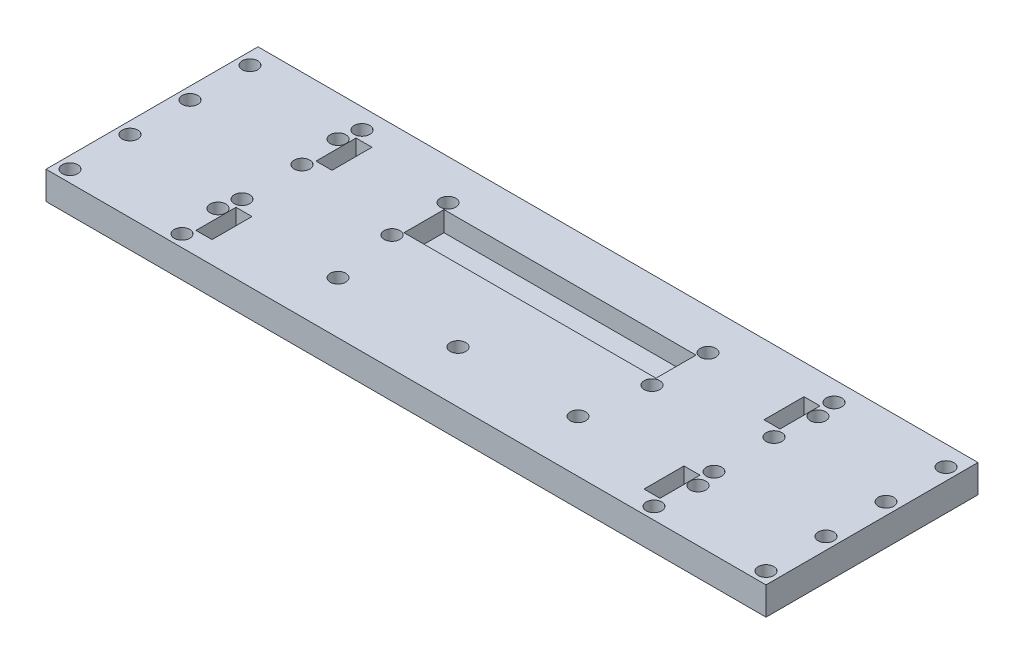
from build123d import *

# Parameters (mm, degrees)
SKETCH_1_W          = 25
SKETCH_1_H          = 30
SKETCH_1_R          = 1.95
SKETCH_1_W_2        = 15
SKETCH_1_H_2        = 60
EXTRUDE_1_DEPTH     = 7
SKETCH_2_R          = 1.95
CUT_EXTRUDE_1_DEPTH = 6
SKETCH_4_W          = 4
SKETCH_4_H          = 10
CUT_EXTRUDE_2_DEPTH = 5
SKETCH_5_W          = 180
SKETCH_5_H          = 7
CUT_EXTRUDE_3_DEPTH = 10
SKETCH_6_W          = 100
SKETCH_6_H          = 7
EXTRUDE_2_DEPTH     = 30
CUT_EXTRUDE_4_DEPTH = 5
CUT_EXTRUDE_5_DEPTH = 5


with BuildPart() as part:
    # 草图1 → 凸台-拉伸1 (new body)
    # profile 1 of 6: a face of its own
    with BuildSketch(Plane(origin=(0, 0, 0), x_dir=(1, 0, 0), z_dir=(0, 1, 0))):
        with Locations((12.5, 45)):
            Rectangle(SKETCH_1_W, SKETCH_1_H)
        with Locations(Location((15, 50, 0), (0, 0, 270))):
            Circle(SKETCH_1_R, mode=Mode.SUBTRACT)
    # profile 2 of 6: a face of its own
    with BuildSketch(Plane(origin=(0, 0, 0), x_dir=(1, 0, 0), z_dir=(0, 1, 0))):
        with BuildLine():
            Line((150, 20), (136.95, 20))
            ThreePointArc((136.95, 20), (135, 18.05), (133.05, 20))
            Line((133.05, 20), (106.95, 20))
            ThreePointArc((106.95, 20), (105, 18.05), (103.05, 20))
            Line((103.05, 20), (76.95, 20))
            ThreePointArc((76.95, 20), (75, 18.05), (73.05, 20))
            Line((73.05, 20), (46.95, 20))
            ThreePointArc((46.95, 20), (45, 18.05), (43.05, 20))
            Line((43.05, 20), (16.95, 20))
            ThreePointArc((16.95, 20), (15, 18.05), (13.05, 20))
            Line((13.05, 20), (0, 20))
            Line((0, 20), (0, 0))
            Line((0, 0), (150, 0))
            Line((150, 0), (150, 20))
        make_face()
    # profile 3 of 6: a face of its own
    with BuildSketch(Plane(origin=(0, 0, 0), x_dir=(1, 0, 0), z_dir=(0, 1, 0))):
        with BuildLine():
            ThreePointArc((133.05, 20), (135, 21.95), (136.95, 20))
            Line((136.95, 20), (150, 20))
            Line((150, 20), (150, 30))
            Line((150, 30), (125, 30))
            Line((125, 30), (25, 30))
            Line((25, 30), (0, 30))
            Line((0, 30), (0, 20))
            Line((0, 20), (13.05, 20))
            ThreePointArc((13.05, 20), (15, 21.95), (16.95, 20))
            Line((16.95, 20), (43.05, 20))
            ThreePointArc((43.05, 20), (45, 21.95), (46.95, 20))
            Line((46.95, 20), (73.05, 20))
            ThreePointArc((73.05, 20), (75, 21.95), (76.95, 20))
            Line((76.95, 20), (103.05, 20))
            ThreePointArc((103.05, 20), (105, 21.95), (106.95, 20))
            Line((106.95, 20), (133.05, 20))
        make_face()
    # profile 4 of 6: a face of its own
    with BuildSketch(Plane(origin=(0, 0, 0), x_dir=(1, 0, 0), z_dir=(0, 1, 0))):
        with Locations((137.5, 45)):
            Rectangle(SKETCH_1_W, SKETCH_1_H)
        with Locations(Location((135, 50, 0), (0, 0, 270))):
            Circle(SKETCH_1_R, mode=Mode.SUBTRACT)
    # profile 5 of 6: a face of its own
    with BuildSketch(Plane(origin=(0, 0, 0), x_dir=(1, 0, 0), z_dir=(0, 1, 0))):
        with Locations((-7.5, 30)):
            Rectangle(SKETCH_1_W_2, SKETCH_1_H_2)
    # profile 6 of 6: a face of its own
    with BuildSketch(Plane(origin=(0, 0, 0), x_dir=(1, 0, 0), z_dir=(0, 1, 0))):
        with Locations((157.5, 30)):
            Rectangle(SKETCH_1_W_2, SKETCH_1_H_2)
    extrude(amount=EXTRUDE_1_DEPTH)

    # 草图2 → 切除-拉伸1 (cut)
    with BuildSketch(Plane(origin=(0, 7, 0), x_dir=(1, 0, 0), z_dir=(0, 1, 0))):
        with BuildLine():
            Line((-12, 53.05), (-12, 55))
            Line((-12, 55), (-10.05, 55))
            ThreePointArc((-10.05, 55), (-13.378858223, 56.378858223), (-12, 53.05))
        make_face()
        with BuildLine():
            Line((-10.05, 55), (-12, 55))
            Line((-12, 55), (-12, 53.05))
            ThreePointArc((-12, 53.05), (-10.621141777, 53.621141777), (-10.05, 55))
        make_face()
        with BuildLine():
            Line((-12, 53.05), (-12, 55))
            Line((-12, 55), (-10.05, 55))
            ThreePointArc((-10.05, 55), (-13.378858223, 56.378858223), (-12, 53.05))
        make_face()
        with BuildLine():
            Line((-10.05, 55), (-12, 55))
            Line((-12, 55), (-12, 53.05))
            ThreePointArc((-12, 53.05), (-10.621141777, 53.621141777), (-10.05, 55))
        make_face()
        with BuildLine():
            ThreePointArc((-10.05, 40), (-10.621141777, 41.378858223), (-12, 41.95))
            Line((-12, 41.95), (-12, 40))
            Line((-12, 40), (-10.05, 40))
        make_face()
        with BuildLine():
            Line((-12, 40), (-12, 41.95))
            ThreePointArc((-12, 41.95), (-13.378858223, 38.621141777), (-10.05, 40))
            Line((-10.05, 40), (-12, 40))
        make_face()
        with BuildLine():
            ThreePointArc((-10.05, 40), (-10.621141777, 41.378858223), (-12, 41.95))
            Line((-12, 41.95), (-12, 40))
            Line((-12, 40), (-10.05, 40))
        make_face()
        with BuildLine():
            Line((-12, 40), (-12, 41.95))
            ThreePointArc((-12, 41.95), (-13.378858223, 38.621141777), (-10.05, 40))
            Line((-10.05, 40), (-12, 40))
        make_face()
        with BuildLine():
            ThreePointArc((17.95, 40), (17.378858223, 41.378858223), (16, 41.95))
            Line((16, 41.95), (16, 40))
            Line((16, 40), (14.05, 40))
            ThreePointArc((14.05, 40), (16, 38.05), (17.95, 40))
        make_face()
        with BuildLine():
            Line((16, 40), (16, 41.95))
            ThreePointArc((16, 41.95), (14.621141777, 41.378858223), (14.05, 40))
            Line((14.05, 40), (16, 40))
        make_face()
        with BuildLine():
            ThreePointArc((17.95, 40), (17.378858223, 41.378858223), (16, 41.95))
            Line((16, 41.95), (16, 40))
            Line((16, 40), (14.05, 40))
            ThreePointArc((14.05, 40), (16, 38.05), (17.95, 40))
        make_face()
        with BuildLine():
            Line((16, 40), (16, 41.95))
            ThreePointArc((16, 41.95), (14.621141777, 41.378858223), (14.05, 40))
            Line((14.05, 40), (16, 40))
        make_face()
        with BuildLine():
            ThreePointArc((17.95, 55), (16, 56.95), (14.05, 55))
            Line((14.05, 55), (16, 55))
            Line((16, 55), (16, 53.05))
            ThreePointArc((16, 53.05), (17.378858223, 53.621141777), (17.95, 55))
        make_face()
        with BuildLine():
            Line((16, 55), (14.05, 55))
            ThreePointArc((14.05, 55), (14.621141777, 53.621141777), (16, 53.05))
            Line((16, 53.05), (16, 55))
        make_face()
        with BuildLine():
            ThreePointArc((17.95, 55), (16, 56.95), (14.05, 55))
            Line((14.05, 55), (16, 55))
            Line((16, 55), (16, 53.05))
            ThreePointArc((16, 53.05), (17.378858223, 53.621141777), (17.95, 55))
        make_face()
        with BuildLine():
            Line((16, 55), (14.05, 55))
            ThreePointArc((14.05, 55), (14.621141777, 53.621141777), (16, 53.05))
            Line((16, 53.05), (16, 55))
        make_face()
        with BuildLine():
            ThreePointArc((-10.05, 10), (-10.621141777, 11.378858223), (-12, 11.95))
            Line((-12, 11.95), (-12, 10))
            Line((-12, 10), (-10.05, 10))
        make_face()
        with BuildLine():
            Line((-12, 10), (-12, 11.95))
            ThreePointArc((-12, 11.95), (-13.378858223, 8.621141777), (-10.05, 10))
            Line((-10.05, 10), (-12, 10))
        make_face()
        with BuildLine():
            ThreePointArc((-10.05, 10), (-10.621141777, 11.378858223), (-12, 11.95))
            Line((-12, 11.95), (-12, 10))
            Line((-12, 10), (-10.05, 10))
        make_face()
        with BuildLine():
            Line((-12, 10), (-12, 11.95))
            ThreePointArc((-12, 11.95), (-13.378858223, 8.621141777), (-10.05, 10))
            Line((-10.05, 10), (-12, 10))
        make_face()
        with BuildLine():
            Line((-10.05, 25), (-12, 25))
            Line((-12, 25), (-12, 23.05))
            ThreePointArc((-12, 23.05), (-10.621141777, 23.621141777), (-10.05, 25))
        make_face()
        with BuildLine():
            Line((-12, 23.05), (-12, 25))
            Line((-12, 25), (-10.05, 25))
            ThreePointArc((-10.05, 25), (-13.378858223, 26.378858223), (-12, 23.05))
        make_face()
        with BuildLine():
            Line((-10.05, 25), (-12, 25))
            Line((-12, 25), (-12, 23.05))
            ThreePointArc((-12, 23.05), (-10.621141777, 23.621141777), (-10.05, 25))
        make_face()
        with BuildLine():
            Line((-12, 23.05), (-12, 25))
            Line((-12, 25), (-10.05, 25))
            ThreePointArc((-10.05, 25), (-13.378858223, 26.378858223), (-12, 23.05))
        make_face()
        with BuildLine():
            ThreePointArc((17.95, 25), (16, 26.95), (14.05, 25))
            Line((14.05, 25), (16, 25))
            Line((16, 25), (16, 23.05))
            ThreePointArc((16, 23.05), (17.378858223, 23.621141777), (17.95, 25))
        make_face()
        with BuildLine():
            Line((16, 25), (14.05, 25))
            ThreePointArc((14.05, 25), (14.621141777, 23.621141777), (16, 23.05))
            Line((16, 23.05), (16, 25))
        make_face()
        with BuildLine():
            ThreePointArc((17.95, 25), (16, 26.95), (14.05, 25))
            Line((14.05, 25), (16, 25))
            Line((16, 25), (16, 23.05))
            ThreePointArc((16, 23.05), (17.378858223, 23.621141777), (17.95, 25))
        make_face()
        with BuildLine():
            Line((16, 25), (14.05, 25))
            ThreePointArc((14.05, 25), (14.621141777, 23.621141777), (16, 23.05))
            Line((16, 23.05), (16, 25))
        make_face()
        with BuildLine():
            ThreePointArc((16, 11.95), (14.621141777, 11.378858223), (14.05, 10))
            Line((14.05, 10), (16, 10))
            Line((16, 10), (16, 11.95))
        make_face()
        with BuildLine():
            Line((16, 10), (14.05, 10))
            ThreePointArc((14.05, 10), (16, 8.05), (17.95, 10))
            ThreePointArc((17.95, 10), (17.378858223, 11.378858223), (16, 11.95))
            Line((16, 11.95), (16, 10))
        make_face()
        with BuildLine():
            ThreePointArc((16, 11.95), (14.621141777, 11.378858223), (14.05, 10))
            Line((14.05, 10), (16, 10))
            Line((16, 10), (16, 11.95))
        make_face()
        with BuildLine():
            Line((16, 10), (14.05, 10))
            ThreePointArc((14.05, 10), (16, 8.05), (17.95, 10))
            ThreePointArc((17.95, 10), (17.378858223, 11.378858223), (16, 11.95))
            Line((16, 11.95), (16, 10))
        make_face()
        with Locations(Location((134, 10, 0), (0, 0, 270))):
            Circle(SKETCH_2_R)
        with Locations(Location((162, 10, 0), (0, 0, 270))):
            Circle(SKETCH_2_R)
        with Locations(Location((162, 25, 0), (0, 0, 270))):
            Circle(SKETCH_2_R)
        with Locations(Location((134, 25, 0), (0, 0, 270))):
            Circle(SKETCH_2_R)
        with Locations(Location((134, 40, 0), (0, 0, 270))):
            Circle(SKETCH_2_R)
        with Locations(Location((134, 55, 0), (0, 0, 270))):
            Circle(SKETCH_2_R)
        with Locations(Location((162, 55, 0), (0, 0, 270))):
            Circle(SKETCH_2_R)
        with Locations(Location((162, 40, 0), (0, 0, 270))):
            Circle(SKETCH_2_R)
    extrude(amount=-CUT_EXTRUDE_1_DEPTH, mode=Mode.SUBTRACT)

    # 草图4 → 切除-拉伸2 (cut)
    with BuildSketch(Plane(origin=(0, 7, 0), x_dir=(1, 0, 0), z_dir=(0, 1, 0))):
        with Locations((131, 47.5)):
            Rectangle(SKETCH_4_W, SKETCH_4_H)
        with Locations((131, 17.5)):
            Rectangle(SKETCH_4_W, SKETCH_4_H)
        with Locations((19, 17.5)):
            Rectangle(SKETCH_4_W, SKETCH_4_H)
        with Locations((19, 47.5)):
            Rectangle(SKETCH_4_W, SKETCH_4_H)
    extrude(amount=-CUT_EXTRUDE_2_DEPTH, mode=Mode.SUBTRACT)

    # 草图5 → 切除-拉伸3 (cut)
    with BuildSketch(Plane(origin=(0, 7, 0), x_dir=(1, 0, 0), z_dir=(0, 1, 0))):
        with Locations((75, 3.5)):
            Rectangle(SKETCH_5_W, SKETCH_5_H)
    extrude(amount=-CUT_EXTRUDE_3_DEPTH, mode=Mode.SUBTRACT)

    # 草图6 → 凸台-拉伸2 (add, through all)
    with BuildSketch(Plane(origin=(0, 0, -30), x_dir=(-1, 0, 0), z_dir=(0, 0, -1))):
        with Locations((-75, 3.5)):
            Rectangle(SKETCH_6_W, SKETCH_6_H)
    extrude(amount=EXTRUDE_2_DEPTH)

    # 草图7 → 切除-拉伸4 (cut)
    with BuildSketch(Plane(origin=(0, 7, 0), x_dir=(1, 0, 0), z_dir=(0, 1, 0))):
        with BuildLine():
            ThreePointArc((42.5, 48.05), (43.878858223, 48.621141777), (44.45, 50))
            Line((44.45, 50), (42.5, 50))
            Line((42.5, 50), (42.5, 48.05))
        make_face()
        with BuildLine():
            Line((42.5, 50), (44.45, 50))
            ThreePointArc((44.45, 50), (41.121141777, 51.378858223), (42.5, 48.05))
            Line((42.5, 48.05), (42.5, 50))
        make_face()
        with BuildLine():
            ThreePointArc((42.5, 48.05), (43.878858223, 48.621141777), (44.45, 50))
            Line((44.45, 50), (42.5, 50))
            Line((42.5, 50), (42.5, 48.05))
        make_face()
        with BuildLine():
            Line((42.5, 50), (44.45, 50))
            ThreePointArc((44.45, 50), (41.121141777, 51.378858223), (42.5, 48.05))
            Line((42.5, 48.05), (42.5, 50))
        make_face()
        with BuildLine():
            ThreePointArc((42.5, 37.95), (41.121141777, 34.621141777), (44.45, 36))
            Line((44.45, 36), (42.5, 36))
            Line((42.5, 36), (42.5, 37.95))
        make_face()
        with BuildLine():
            Line((42.5, 36), (44.45, 36))
            ThreePointArc((44.45, 36), (43.878858223, 37.378858223), (42.5, 37.95))
            Line((42.5, 37.95), (42.5, 36))
        make_face()
        with BuildLine():
            ThreePointArc((42.5, 37.95), (41.121141777, 34.621141777), (44.45, 36))
            Line((44.45, 36), (42.5, 36))
            Line((42.5, 36), (42.5, 37.95))
        make_face()
        with BuildLine():
            Line((42.5, 36), (44.45, 36))
            ThreePointArc((44.45, 36), (43.878858223, 37.378858223), (42.5, 37.95))
            Line((42.5, 37.95), (42.5, 36))
        make_face()
        with BuildLine():
            ThreePointArc((107.5, 37.95), (106.121141777, 37.378858223), (105.55, 36))
            Line((105.55, 36), (107.5, 36))
            Line((107.5, 36), (107.5, 37.95))
        make_face()
        with BuildLine():
            Line((107.5, 36), (105.55, 36))
            ThreePointArc((105.55, 36), (107.5, 34.05), (109.45, 36))
            ThreePointArc((109.45, 36), (108.878858223, 37.378858223), (107.5, 37.95))
            Line((107.5, 37.95), (107.5, 36))
        make_face()
        with BuildLine():
            ThreePointArc((107.5, 37.95), (106.121141777, 37.378858223), (105.55, 36))
            Line((105.55, 36), (107.5, 36))
            Line((107.5, 36), (107.5, 37.95))
        make_face()
        with BuildLine():
            Line((107.5, 36), (105.55, 36))
            ThreePointArc((105.55, 36), (107.5, 34.05), (109.45, 36))
            ThreePointArc((109.45, 36), (108.878858223, 37.378858223), (107.5, 37.95))
            Line((107.5, 37.95), (107.5, 36))
        make_face()
        with BuildLine():
            ThreePointArc((109.45, 50), (107.5, 51.95), (105.55, 50))
            Line((105.55, 50), (107.5, 50))
            Line((107.5, 50), (107.5, 48.05))
            ThreePointArc((107.5, 48.05), (108.878858223, 48.621141777), (109.45, 50))
        make_face()
        with BuildLine():
            Line((107.5, 50), (105.55, 50))
            ThreePointArc((105.55, 50), (106.121141777, 48.621141777), (107.5, 48.05))
            Line((107.5, 48.05), (107.5, 50))
        make_face()
        with BuildLine():
            ThreePointArc((109.45, 50), (107.5, 51.95), (105.55, 50))
            Line((105.55, 50), (107.5, 50))
            Line((107.5, 50), (107.5, 48.05))
            ThreePointArc((107.5, 48.05), (108.878858223, 48.621141777), (109.45, 50))
        make_face()
        with BuildLine():
            Line((107.5, 50), (105.55, 50))
            ThreePointArc((105.55, 50), (106.121141777, 48.621141777), (107.5, 48.05))
            Line((107.5, 48.05), (107.5, 50))
        make_face()
    extrude(amount=-CUT_EXTRUDE_4_DEPTH, mode=Mode.SUBTRACT)

    # 草图8 → 切除-拉伸5 (cut)
    with BuildSketch(Plane(origin=(0, 7, 0), x_dir=(1, 0, 0), z_dir=(0, 1, 0))):
        Polygon((75, 43), (75, 38), (106.5, 38), (106.5, 48), (98.214285714, 48), align=None)
        Polygon((75, 48), (75, 43), (98.214285714, 48), align=None)
        Polygon((51.785714286, 38), (75, 43), (75, 48), (43.5, 48), (43.5, 38), align=None)
        Polygon((51.785714286, 38), (75, 38), (75, 43), align=None)
    extrude(amount=-CUT_EXTRUDE_5_DEPTH, mode=Mode.SUBTRACT)


solid = part.part
